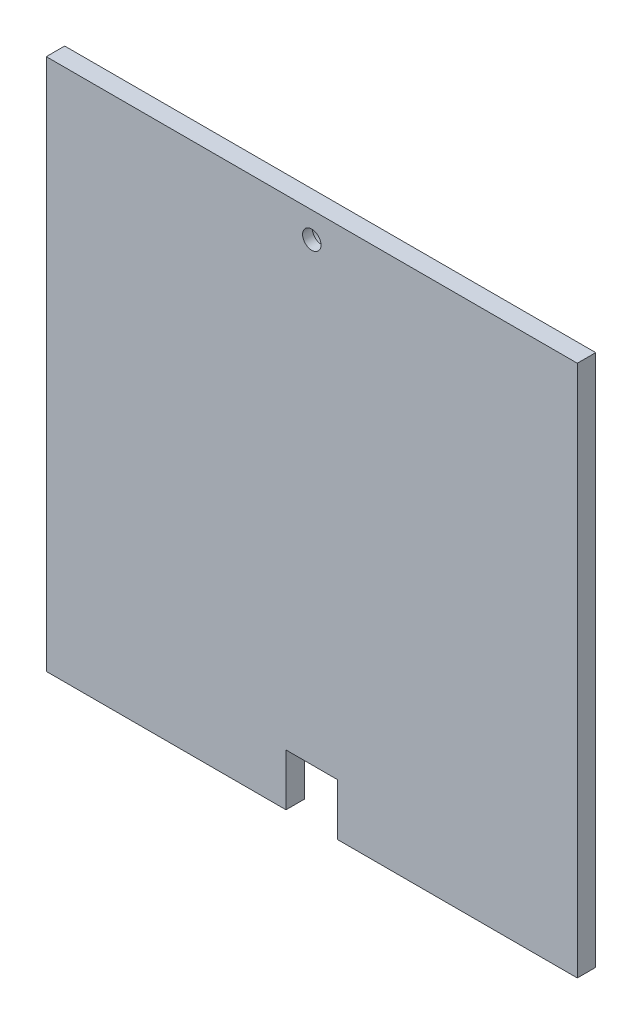
from build123d import *

# Parameters (mm, degrees)
ESQUISSE1_W             = 432.465319529
ESQUISSE1_H             = 1000
BOSS_EXTRU_1_DEPTH      = 15
ESQUISSE2_W             = 15
ESQUISSE2_H             = 180
ENL_V_MAT_EXTRU_1_DEPTH = 1090.610596771
ESQUISSE3_W             = 15
ESQUISSE3_H             = 386.42955672
ENL_V_MAT_EXTRU_2_DEPTH = 928.173798484
ESQUISSE4_W             = 42
ESQUISSE4_H             = 42.455270474
ENL_V_MAT_EXTRU_3_DEPTH = 863.948765929
ENL_V_MAT_EXTRU_4_DEPTH = 7
ESQUISSE6_R             = 7.5
ENL_V_MAT_EXTRU_5_DEPTH = 863.85547609


with BuildPart() as part:
    # Esquisse1 → Boss.-Extru.1 (new body)
    with BuildSketch(Plane.XY):
        with Locations((-52.199031023, -500)):
            Rectangle(ESQUISSE1_W, ESQUISSE1_H)
    extrude(amount=BOSS_EXTRU_1_DEPTH)

    # Esquisse2 → Enlèv. mat.-Extru.1 (cut, through all)
    with BuildSketch(Plane(origin=(164.033628742, 0, 0), x_dir=(0, 0, -1), z_dir=(1, 0, 0))):
        with Locations((-7.5, -910)):
            Rectangle(ESQUISSE2_W, ESQUISSE2_H)
    extrude(amount=-ENL_V_MAT_EXTRU_1_DEPTH, mode=Mode.SUBTRACT)

    # Esquisse3 → Enlèv. mat.-Extru.2 (cut, through all)
    with BuildSketch(Plane.ZY.offset(268.431690787)):
        with Locations((7.5, -193.21477836)):
            Rectangle(ESQUISSE3_W, ESQUISSE3_H)
    extrude(amount=-ENL_V_MAT_EXTRU_2_DEPTH, mode=Mode.SUBTRACT)

    # Esquisse4 → Enlèv. mat.-Extru.3 (cut, through all)
    with BuildSketch(Plane(origin=(0, 0, 0), x_dir=(-1, 0, 0), z_dir=(0, 0, -1))):
        with Locations((52.199031023, -799)):
            Rectangle(ESQUISSE4_W, ESQUISSE4_H)
    extrude(amount=-ENL_V_MAT_EXTRU_3_DEPTH, mode=Mode.SUBTRACT)

    # Esquisse5 → Enlèv. mat.-Extru.4 (cut)
    with BuildSketch(Plane(origin=(0, 0, 0), x_dir=(-1, 0, 0), z_dir=(0, 0, -1))):
        with BuildLine():
            ThreePointArc((52.199031023, -418.42955672), (63.199031023, -407.42955672), (52.199031023, -396.42955672))
            ThreePointArc((52.199031023, -396.42955672), (41.199031023, -407.42955672), (52.199031023, -418.42955672))
        make_face()
    extrude(amount=-ENL_V_MAT_EXTRU_4_DEPTH, mode=Mode.SUBTRACT)

    # Esquisse6 → Enlèv. mat.-Extru.5 (cut, through all)
    with BuildSketch(Plane(origin=(0, 0, 7), x_dir=(-1, 0, 0), z_dir=(0, 0, -1))):
        with Locations((52.199031023, -407.42955672)):
            Circle(ESQUISSE6_R)
    extrude(amount=-ENL_V_MAT_EXTRU_5_DEPTH, mode=Mode.SUBTRACT)


solid = part.part
